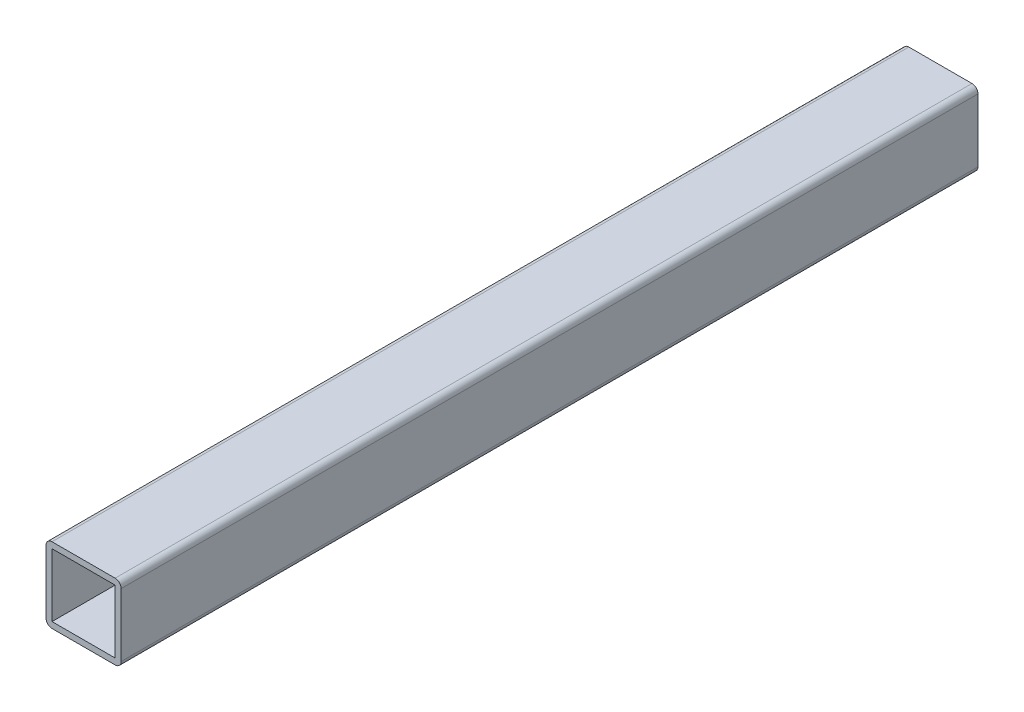
from build123d import *

# Parameters (mm, degrees)
SKETCH_1_W      = 42
SKETCH_1_H      = 42
EXTRUDE_1_DEPTH = 570


with BuildPart() as part:
    # Эскиз1 → Бобышка-Вытянуть1 (new body)
    with BuildSketch(Plane.XY):
        with BuildLine():
            Line((4, 0), (46, 0))
            ThreePointArc((46, 0), (48.828427125, 1.171572875), (50, 4))
            Line((50, 4), (50, 46))
            ThreePointArc((50, 46), (48.828427125, 48.828427125), (46, 50))
            Line((46, 50), (4, 50))
            ThreePointArc((4, 50), (1.171572875, 48.828427125), (0, 46))
            Line((0, 46), (0, 4))
            ThreePointArc((0, 4), (1.171572875, 1.171572875), (4, 0))
        make_face()
        with Locations((25, 25)):
            Rectangle(SKETCH_1_W, SKETCH_1_H, mode=Mode.SUBTRACT)
    extrude(amount=EXTRUDE_1_DEPTH)


solid = part.part
